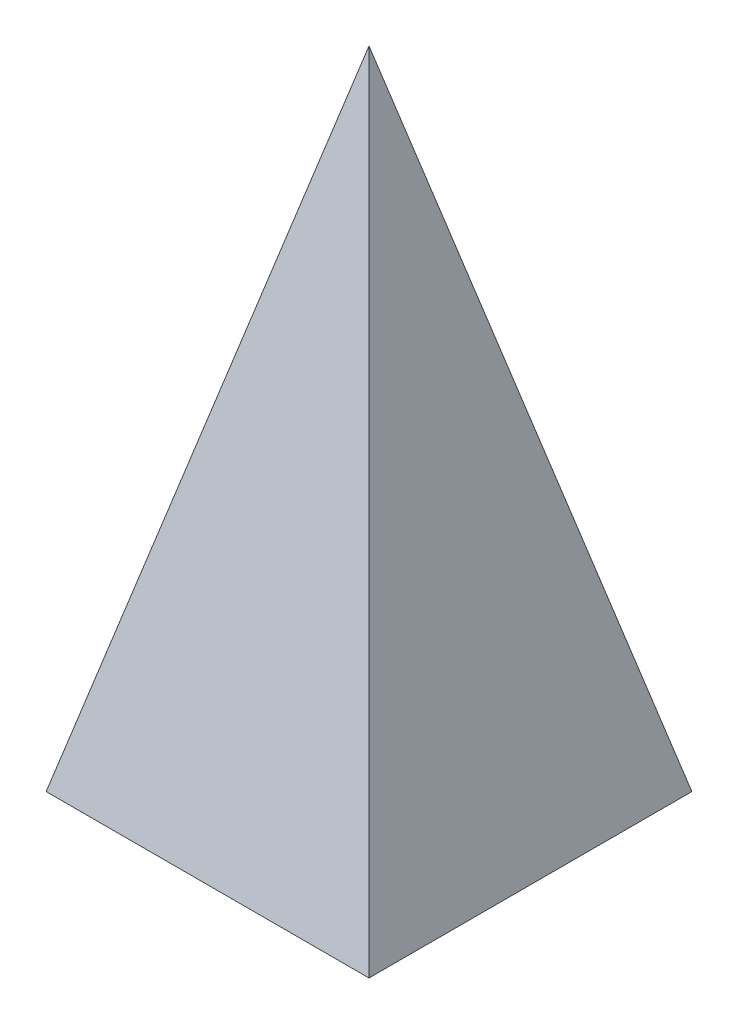
from build123d import *


with BuildPart() as part:
    # 草图1 → 放样1 section 0
    with BuildSketch(Plane(origin=(0, 0, 0), x_dir=(1, 0, 0), z_dir=(0, 1, 0)), mode=Mode.PRIVATE) as loft_1_s0:
        with BuildLine():
            Line((-10, 10), (10, 10))
            Line((10, 10), (10, -10))
            Line((10, -10), (-10, -10))
            Line((-10, -10), (-10, 10))
        make_face()
    loft([Vertex(0, 40, 0), loft_1_s0.sketch])


solid = part.part
